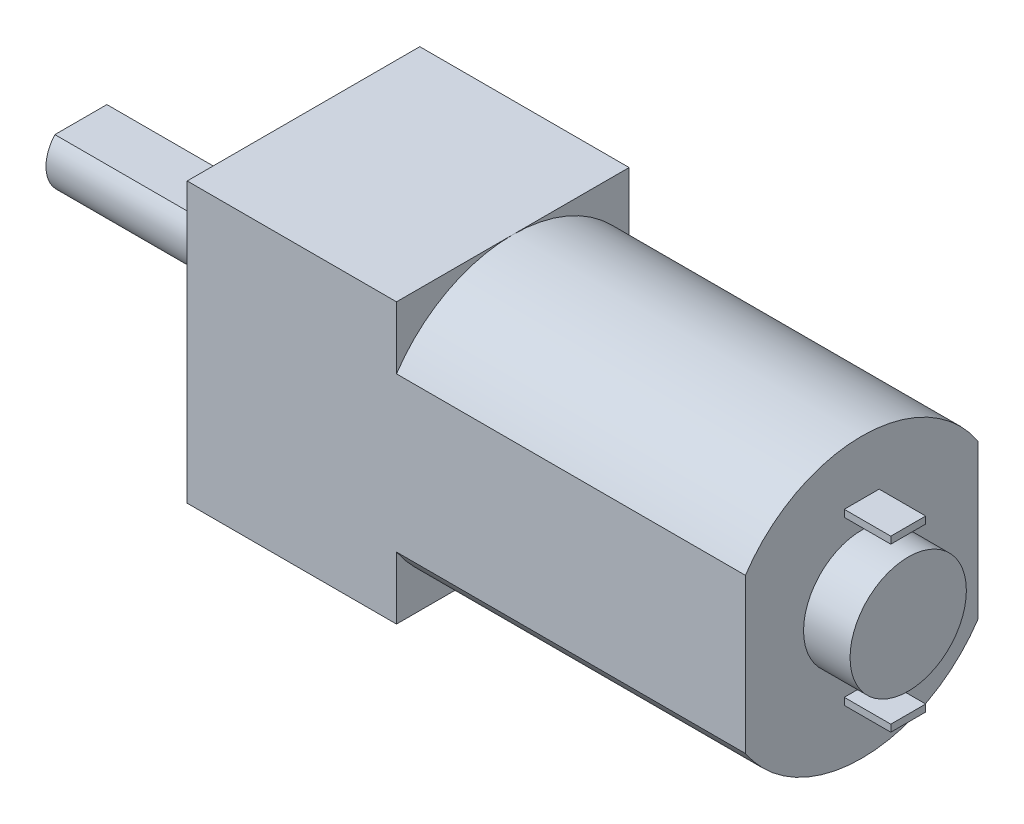
from build123d import *

# Parameters (mm, degrees)
SKETCH6_W           = 15
SKETCH6_H           = 6
SKETCH8_W           = 10
SKETCH8_H           = 12
BOSS_EXTRUDE2_DEPTH = 9
SKETCH9_W           = 1
SKETCH9_H           = 12
CUT_EXTRUDE2_DEPTH  = 15
SKETCH10_R          = 1.95
BOSS_EXTRUDE3_DEPTH = 0.9
SKETCH11_R          = 1.5
BOSS_EXTRUDE4_DEPTH = 8.67
SKETCH12_W          = 2.491987158
SKETCH12_H          = 0.5
CUT_EXTRUDE3_DEPTH  = 8.67
SKETCH13_R          = 2.5
SKETCH13_W          = 1.5
SKETCH13_H          = 0.3
BOSS_EXTRUDE5_DEPTH = 2


with BuildPart() as part:
    # Sketch6 → Revolve-Thin2 (revolve)
    with BuildSketch(Plane(origin=(0, 0, 0), x_dir=(1, 0, 0), z_dir=(0, 1, 0)), mode=Mode.PRIVATE) as revolve_thin2_sk:
        with Locations((7.5, 3)):
            Rectangle(SKETCH6_W, SKETCH6_H)
    revolve(revolve_thin2_sk.sketch.rotate(Axis((0, 0, 0), (1, 0, 0)), 180), axis=Axis((0, 0, 0), (1, 0, 0)))

    # Sketch8 → Boss-Extrude2 (add)
    with BuildSketch(Plane.ZY):
        Rectangle(SKETCH8_W, SKETCH8_H)
    extrude(amount=BOSS_EXTRUDE2_DEPTH)

    # Sketch9 → Cut-Extrude2 (cut)
    with BuildSketch(Plane.ZY):
        with Locations((5.5, 0)):
            Rectangle(SKETCH9_W, SKETCH9_H)
        with Locations((-5.5, 0)):
            Rectangle(SKETCH9_W, SKETCH9_H)
    extrude(amount=-CUT_EXTRUDE2_DEPTH, mode=Mode.SUBTRACT)

    # Sketch10 → Boss-Extrude3 (add)
    with BuildSketch(Plane.ZY.offset(9)):
        with Locations(Location((0, 0, 0), (0, 0, 180))):
            Circle(SKETCH10_R)
    extrude(amount=BOSS_EXTRUDE3_DEPTH)

    # Sketch11 → Boss-Extrude4 (add)
    with BuildSketch(Plane.ZY.offset(9.9)):
        Circle(SKETCH11_R)
    extrude(amount=BOSS_EXTRUDE4_DEPTH)

    # Sketch12 → Cut-Extrude3 (cut)
    with BuildSketch(Plane.ZY.offset(18.57)):
        with Locations((0, 1.25)):
            Rectangle(SKETCH12_W, SKETCH12_H)
    extrude(amount=-CUT_EXTRUDE3_DEPTH, mode=Mode.SUBTRACT)

    # Sketch13 → Boss-Extrude5 (add)
    with BuildSketch(Plane(origin=(15, 0, 0), x_dir=(0, 0, -1), z_dir=(1, 0, 0))):
        with Locations(Location((0, 0, 0), (0, 0, 180))):
            Circle(SKETCH13_R)
        with Locations((0, 3.5)):
            Rectangle(SKETCH13_W, SKETCH13_H)
        with Locations((0, -3.5)):
            Rectangle(SKETCH13_W, SKETCH13_H)
    extrude(amount=BOSS_EXTRUDE5_DEPTH)


solid = part.part
